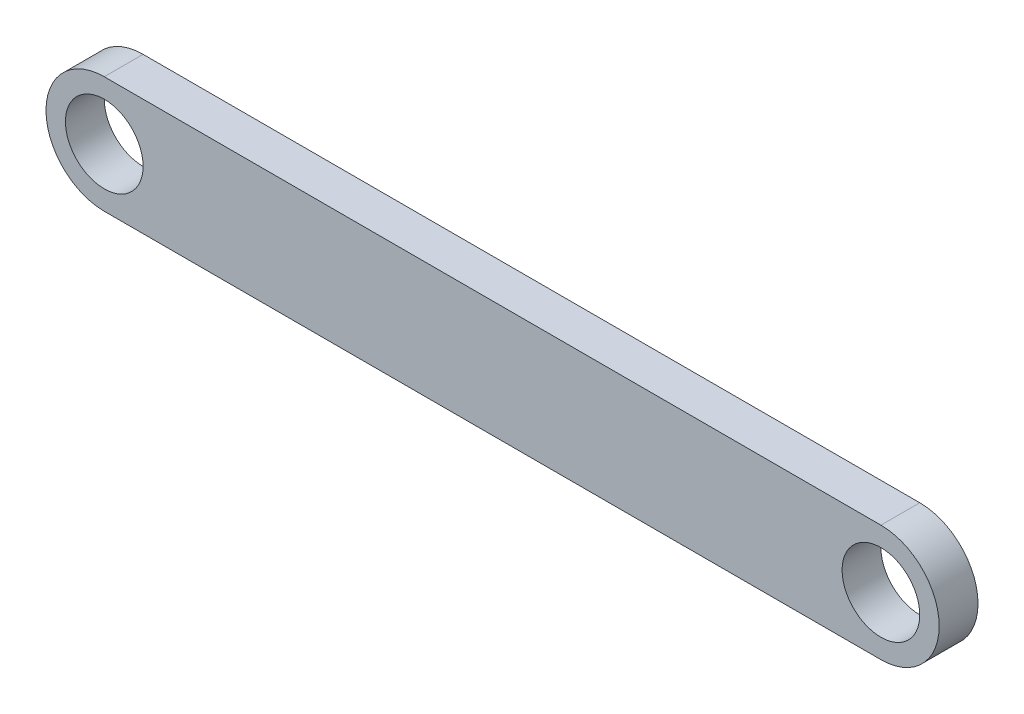
from build123d import *

# Parameters (mm, degrees)
SKETCH1_W           = 200
SKETCH1_H           = 30
BOSS_EXTRUDE1_DEPTH = 10
BOSS_EXTRUDE2_DEPTH = 10
SKETCH4_R           = 10
CUT_EXTRUDE2_DEPTH  = 10


with BuildPart() as part:
    # Sketch1 → Boss-Extrude1 (new body)
    with BuildSketch(Plane.XY):
        with Locations((0, -15)):
            Rectangle(SKETCH1_W, SKETCH1_H)
    extrude(amount=BOSS_EXTRUDE1_DEPTH)

    # Sketch3 → Boss-Extrude2 (add)
    with BuildSketch(Plane.XY.offset(10)):
        with BuildLine():
            Line((-100, 0), (-100, -30))
            ThreePointArc((-100, -30), (-115, -15), (-100, 0))
        make_face()
        with BuildLine():
            Line((100, 0), (100, -30))
            ThreePointArc((100, -30), (115, -15), (100, 0))
        make_face()
    extrude(amount=-BOSS_EXTRUDE2_DEPTH)

    # Sketch4 → Cut-Extrude2 (cut)
    with BuildSketch(Plane.XY.offset(10)):
        with Locations((-100, -15)):
            Circle(SKETCH4_R)
        with Locations(Location((100, -15, 0), (0, 0, 180))):
            Circle(SKETCH4_R)
    extrude(amount=-CUT_EXTRUDE2_DEPTH, mode=Mode.SUBTRACT)


solid = part.part
